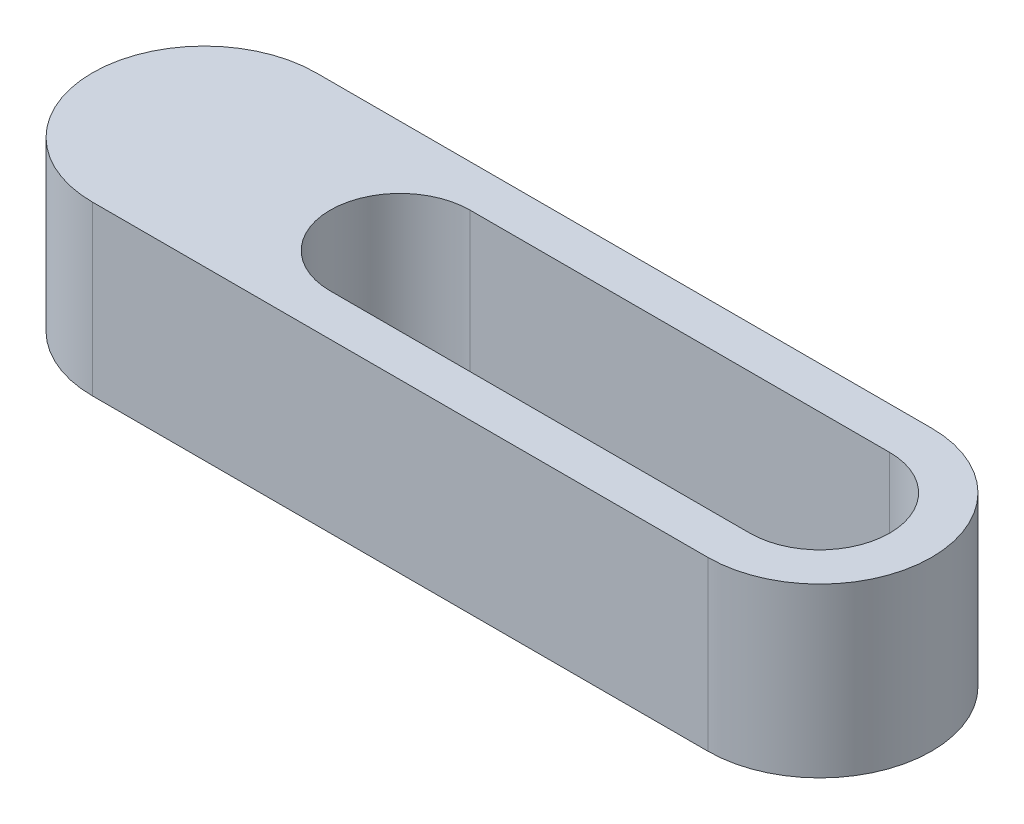
from build123d import *

# Parameters (mm, degrees)
Y_KSEKLIK_EKSTR_ZYON1_DEPTH  = 1
Y_KSEKLIK_EKSTR_ZYON2_DEPTH  = 5
IZIM3_W                      = 4
IZIM3_H                      = 1
KES_EKSTR_ZYON1_DEPTH        = 1
RADYUS1_R                    = 0.1
Y_KSEKLIK_EKSTR_ZYON4_DEPTH  = 9
Y_KSEKLIK_EKSTR_ZYON5_DEPTH  = 2.5
Y_KSEKLIK_EKSTR_ZYON6_DEPTH  = 3.5
Y_KSEKLIK_EKSTR_ZYON7_DEPTH  = 1
KES_EKSTR_ZYON2_DEPTH        = 1
Y_KSEKLIK_EKSTR_ZYON8_START  = 3
Y_KSEKLIK_EKSTR_ZYON8_DEPTH  = 3
RADYUS2_R                    = 0.5
Y_KSEKLIK_EKSTR_ZYON9_START  = 1
Y_KSEKLIK_EKSTR_ZYON9_DEPTH  = 1
IZIM11_R                     = 2.5
KES_EKSTR_ZYON3_DEPTH        = 10
IZIM15_R                     = 0.25
Y_KSEKLIK_EKSTR_ZYON12_DEPTH = 11
IZIM19_R                     = 2.25
Y_KSEKLIK_EKSTR_ZYON17_DEPTH = 5
IZIM20_R                     = 4.75
Y_KSEKLIK_EKSTR_ZYON18_DEPTH = 3
IZIM21_R                     = 0.75
KES_EKSTR_ZYON5_DEPTH        = 10
IZIM22_R                     = 0.5
Y_KSEKLIK_EKSTR_ZYON19_DEPTH = 5
IZIM23_R                     = 4
Y_KSEKLIK_EKSTR_ZYON20_DEPTH = 2
IZIM24_R                     = 0.75
Y_KSEKLIK_EKSTR_ZYON21_DEPTH = 7
IZIM25_R                     = 3.5
Y_KSEKLIK_EKSTR_ZYON22_DEPTH = 1
IZIM26_R                     = 4.5
Y_KSEKLIK_EKSTR_ZYON23_DEPTH = 1
KES_EKSTR_ZYON7_DEPTH        = 30
Y_KSEKLIK_EKSTR_ZYON33_DEPTH = 1
Y_KSEKLIK_EKSTR_ZYON34_DEPTH = 14
IZIM37_W                     = 8
IZIM37_H                     = 6
Y_KSEKLIK_EKSTR_ZYON36_DEPTH = 1
IZIM39_W                     = 4
IZIM39_H                     = 1
Y_KSEKLIK_EKSTR_ZYON37_DEPTH = 0.1
IZIM40_R                     = 0.4
Y_KSEKLIK_EKSTR_ZYON38_DEPTH = 2
IZIM41_R                     = 0.15
KES_EKSTR_ZYON8_DEPTH        = 5
SKETCH1_W                    = 21.818438076
SKETCH1_H                    = 34.383141715
CUT_EXTRUDE1_DEPTH           = 26
BOSS_EXTRUDE1_DEPTH          = 6
CUT_EXTRUDE2_START           = -8
CUT_EXTRUDE2_DEPTH           = 8


with BuildPart() as part:
    # Çizim1 → Yükseklik-Ekstrüzyon1 (new body)
    with BuildSketch(Plane(origin=(0, 0, 0), x_dir=(1, 0, 0), z_dir=(0, 1, 0))):
        with BuildLine():
            Line((-5.5, 11.25), (5.5, 11.25))
            ThreePointArc((5.5, 11.25), (5.853553391, 11.103553391), (6, 10.75))
            Line((6, 10.75), (6, -10.75))
            ThreePointArc((6, -10.75), (5.853553391, -11.103553391), (5.5, -11.25))
            Line((5.5, -11.25), (-5.5, -11.25))
            ThreePointArc((-5.5, -11.25), (-5.853553391, -11.103553391), (-6, -10.75))
            Line((-6, -10.75), (-6, 10.75))
            ThreePointArc((-6, 10.75), (-5.853553391, 11.103553391), (-5.5, 11.25))
        make_face()
    extrude(amount=Y_KSEKLIK_EKSTR_ZYON1_DEPTH)

    # Çizim2 → Yükseklik-Ekstrüzyon2 (add)
    with BuildSketch(Plane(origin=(0, 1, 0), x_dir=(1, 0, 0), z_dir=(0, 1, 0))):
        with BuildLine():
            Line((-5.5, 11.25), (5.5, 11.25))
            ThreePointArc((5.5, 11.25), (5.853553391, 11.103553391), (6, 10.75))
            Line((6, 10.75), (6, -10.75))
            ThreePointArc((6, -10.75), (5.853553391, -11.103553391), (5.5, -11.25))
            Line((5.5, -11.25), (-5.5, -11.25))
            ThreePointArc((-5.5, -11.25), (-5.853553391, -11.103553391), (-6, -10.75))
            Line((-6, -10.75), (-6, 10.75))
            ThreePointArc((-6, 10.75), (-5.853553391, 11.103553391), (-5.5, 11.25))
        make_face()
        with BuildLine():
            Line((-5, 9.25), (-5, -9.25))
            ThreePointArc((-5, -9.25), (-4.292893219, -9.542893219), (-4, -10.25))
            Line((-4, -10.25), (4, -10.25))
            ThreePointArc((4, -10.25), (4.292893219, -9.542893219), (5, -9.25))
            Line((5, -9.25), (5, 9.25))
            ThreePointArc((5, 9.25), (4.292893219, 9.542893219), (4, 10.25))
            Line((4, 10.25), (-4, 10.25))
            ThreePointArc((-4, 10.25), (-4.292893219, 9.542893219), (-5, 9.25))
        make_face(mode=Mode.SUBTRACT)
    extrude(amount=Y_KSEKLIK_EKSTR_ZYON2_DEPTH)

    # Çizim3 → Kes-Ekstrüzyon1 (cut)
    with BuildSketch(Plane(origin=(0, 6, 0), x_dir=(1, 0, 0), z_dir=(0, 1, 0))):
        with Locations((0, -10.75)):
            Rectangle(IZIM3_W, IZIM3_H)
    extrude(amount=-KES_EKSTR_ZYON1_DEPTH, mode=Mode.SUBTRACT)

    # Radyus1
    radyus1_edges = [part.edges().sort_by_distance(p)[0] for p in [
        (2, 5, 10.75),
        (-2, 5, 10.75),
    ]]
    fillet(radyus1_edges, radius=RADYUS1_R)

    # Çizim4 → Yükseklik-Ekstrüzyon4 (add)
    with BuildSketch(Plane(origin=(0, 6, 0), x_dir=(1, 0, 0), z_dir=(0, 1, 0))):
        with BuildLine():
            Line((-5.5, 11.25), (5.5, 11.25))
            ThreePointArc((5.5, 11.25), (5.853553391, 11.103553391), (6, 10.75))
            Line((6, 10.75), (6, -10.75))
            ThreePointArc((6, -10.75), (5.853553391, -11.103553391), (5.5, -11.25))
            Line((5.5, -11.25), (-5.5, -11.25))
            ThreePointArc((-5.5, -11.25), (-5.853553391, -11.103553391), (-6, -10.75))
            Line((-6, -10.75), (-6, 10.75))
            ThreePointArc((-6, 10.75), (-5.853553391, 11.103553391), (-5.5, 11.25))
        make_face()
        with BuildLine():
            Line((-4, 10.25), (4, 10.25))
            ThreePointArc((4, 10.25), (4.292893219, 9.542893219), (5, 9.25))
            Line((5, 9.25), (5, -9.25))
            ThreePointArc((5, -9.25), (4.292893219, -9.542893219), (4, -10.25))
            Line((4, -10.25), (-4, -10.25))
            ThreePointArc((-4, -10.25), (-4.292893219, -9.542893219), (-5, -9.25))
            Line((-5, -9.25), (-5, 9.25))
            ThreePointArc((-5, 9.25), (-4.292893219, 9.542893219), (-4, 10.25))
        make_face(mode=Mode.SUBTRACT)
    extrude(amount=Y_KSEKLIK_EKSTR_ZYON4_DEPTH)

    # Çizim6 → Yükseklik-Ekstrüzyon5 (add)
    with BuildSketch(Plane(origin=(0, 15, 0), x_dir=(1, 0, 0), z_dir=(0, 1, 0))):
        with BuildLine():
            Line((-5.5, 16), (-0.7, 16))
            ThreePointArc((-0.7, 16), (-0.558578644, 15.941421356), (-0.5, 15.8))
            Line((-0.5, 15.8), (-0.5, 14.224679434))
            ThreePointArc((-0.5, 14.224679434), (-0.522048696, 14.133392342), (-0.583333333, 14.062232862))
            ThreePointArc((-0.583333333, 14.062232862), (0, 12.25), (0.583333333, 14.062232862))
            ThreePointArc((0.583333333, 14.062232862), (0.522048696, 14.133392342), (0.5, 14.224679434))
            Line((0.5, 14.224679434), (0.5, 15.8))
            ThreePointArc((0.5, 15.8), (0.558578644, 15.941421356), (0.7, 16))
            Line((0.7, 16), (5.5, 16))
            ThreePointArc((5.5, 16), (5.853553391, 15.853553391), (6, 15.5))
            Line((6, 15.5), (6, -15.5))
            ThreePointArc((6, -15.5), (5.853553391, -15.853553391), (5.5, -16))
            Line((5.5, -16), (0.7, -16))
            ThreePointArc((0.7, -16), (0.558578644, -15.941421356), (0.5, -15.8))
            Line((0.5, -15.8), (0.5, -14.224679434))
            ThreePointArc((0.5, -14.224679434), (0.522048696, -14.133392342), (0.583333333, -14.062232862))
            ThreePointArc((0.583333333, -14.062232862), (0, -12.25), (-0.583333333, -14.062232862))
            ThreePointArc((-0.583333333, -14.062232862), (-0.522048696, -14.133392342), (-0.5, -14.224679434))
            Line((-0.5, -14.224679434), (-0.5, -15.8))
            ThreePointArc((-0.5, -15.8), (-0.558578644, -15.941421356), (-0.7, -16))
            Line((-0.7, -16), (-5.5, -16))
            ThreePointArc((-5.5, -16), (-5.853553391, -15.853553391), (-6, -15.5))
            Line((-6, -15.5), (-6, 15.5))
            ThreePointArc((-6, 15.5), (-5.853553391, 15.853553391), (-5.5, 16))
        make_face()
        with BuildLine():
            Line((-4, 10.25), (4, 10.25))
            ThreePointArc((4, 10.25), (4.292893219, 9.542893219), (5, 9.25))
            Line((5, 9.25), (5, -9.25))
            ThreePointArc((5, -9.25), (4.292893219, -9.542893219), (4, -10.25))
            Line((4, -10.25), (-4, -10.25))
            ThreePointArc((-4, -10.25), (-4.292893219, -9.542893219), (-5, -9.25))
            Line((-5, -9.25), (-5, 9.25))
            ThreePointArc((-5, 9.25), (-4.292893219, 9.542893219), (-4, 10.25))
        make_face(mode=Mode.SUBTRACT)
    extrude(amount=Y_KSEKLIK_EKSTR_ZYON5_DEPTH)

    # Çizim7 → Yükseklik-Ekstrüzyon6 (add)
    with BuildSketch(Plane(origin=(0, 17.5, 0), x_dir=(1, 0, 0), z_dir=(0, 1, 0))):
        with BuildLine():
            Line((5.5, 11.25), (-5.5, 11.25))
            ThreePointArc((-5.5, 11.25), (-5.853553391, 11.103553391), (-6, 10.75))
            Line((-6, 10.75), (-6, -10.75))
            ThreePointArc((-6, -10.75), (-5.853553391, -11.103553391), (-5.5, -11.25))
            Line((-5.5, -11.25), (5.5, -11.25))
            ThreePointArc((5.5, -11.25), (5.853553391, -11.103553391), (6, -10.75))
            Line((6, -10.75), (6, 10.75))
            ThreePointArc((6, 10.75), (5.853553391, 11.103553391), (5.5, 11.25))
        make_face()
        with BuildLine():
            Line((-5, -9.25), (-5, 9.25))
            ThreePointArc((-5, 9.25), (-4.292893219, 9.542893219), (-4, 10.25))
            Line((-4, 10.25), (4, 10.25))
            ThreePointArc((4, 10.25), (4.292893219, 9.542893219), (5, 9.25))
            Line((5, 9.25), (5, -9.25))
            ThreePointArc((5, -9.25), (4.292893219, -9.542893219), (4, -10.25))
            Line((4, -10.25), (-4, -10.25))
            ThreePointArc((-4, -10.25), (-4.292893219, -9.542893219), (-5, -9.25))
        make_face(mode=Mode.SUBTRACT)
    extrude(amount=Y_KSEKLIK_EKSTR_ZYON6_DEPTH)

    # Çizim8 → Yükseklik-Ekstrüzyon7 (add)
    with BuildSketch(Plane(origin=(0, 21, 0), x_dir=(1, 0, 0), z_dir=(0, 1, 0))):
        with BuildLine():
            Line((-5.5, 11.25), (5.5, 11.25))
            ThreePointArc((5.5, 11.25), (5.853553391, 11.103553391), (6, 10.75))
            Line((6, 10.75), (6, -10.75))
            ThreePointArc((6, -10.75), (5.853553391, -11.103553391), (5.5, -11.25))
            Line((5.5, -11.25), (-5.5, -11.25))
            ThreePointArc((-5.5, -11.25), (-5.853553391, -11.103553391), (-6, -10.75))
            Line((-6, -10.75), (-6, 10.75))
            ThreePointArc((-6, 10.75), (-5.853553391, 11.103553391), (-5.5, 11.25))
        make_face()
    extrude(amount=Y_KSEKLIK_EKSTR_ZYON7_DEPTH)

    # Çizim9 → Kes-Ekstrüzyon2 (cut)
    with BuildSketch(Plane(origin=(0, 22, 0), x_dir=(1, 0, 0), z_dir=(0, 1, 0))):
        with BuildLine():
            ThreePointArc((1.015291078, 0.354166667), (0, 10.25), (-1.015291078, 0.354166667))
            ThreePointArc((-1.015291078, 0.354166667), (0, -2.25), (1.015291078, 0.354166667))
        make_face()
    extrude(amount=-KES_EKSTR_ZYON2_DEPTH, mode=Mode.SUBTRACT)

    # Çizim9<3> → Yükseklik-Ekstrüzyon8 (add)
    with BuildSketch(Plane(origin=(0, 22, 0), x_dir=(1, 0, 0), z_dir=(0, 1, 0)).offset(Y_KSEKLIK_EKSTR_ZYON8_START)):
        with BuildLine():
            ThreePointArc((2.445144707, -0.229166667), (0, 11.25), (-2.445144707, -0.229166667))
            ThreePointArc((-2.445144707, -0.229166667), (0, -3.25), (2.445144707, -0.229166667))
        make_face()
        with BuildLine():
            ThreePointArc((1.015291078, 0.354166667), (0, 10.25), (-1.015291078, 0.354166667))
            ThreePointArc((-1.015291078, 0.354166667), (0, -2.25), (1.015291078, 0.354166667))
        make_face(mode=Mode.SUBTRACT)
    extrude(amount=-Y_KSEKLIK_EKSTR_ZYON8_DEPTH)

    # Radyus2
    radyus2_edges = [part.edges().sort_by_distance(p)[0] for p in [
        (-1.015291078, 23, -0.354166667),
        (1.015291078, 23, -0.354166667),
    ]]
    fillet(radyus2_edges, radius=RADYUS2_R)

    # Çizim10 → Yükseklik-Ekstrüzyon9 (add)
    with BuildSketch(Plane(origin=(0, 25, 0), x_dir=(1, 0, 0), z_dir=(0, 1, 0)).offset(Y_KSEKLIK_EKSTR_ZYON9_START)):
        with BuildLine():
            ThreePointArc((2.445144707, -0.229166667), (0, 11.25), (-2.445144707, -0.229166667))
            ThreePointArc((-2.445144707, -0.229166667), (0, -3.25), (2.445144707, -0.229166667))
        make_face()
    extrude(amount=-Y_KSEKLIK_EKSTR_ZYON9_DEPTH)

    # Çizim11 → Kes-Ekstrüzyon3 (cut)
    with BuildSketch(Plane(origin=(0, 26, 0), x_dir=(1, 0, 0), z_dir=(0, 1, 0))):
        with Locations(Location((0, 5.25, 0), (0, 0, 270))):
            Circle(IZIM11_R)
    extrude(amount=-KES_EKSTR_ZYON3_DEPTH, mode=Mode.SUBTRACT)

    # Çizim15 → Yükseklik-Ekstrüzyon12 (add)
    with BuildSketch(Plane(origin=(0, 26, 0), x_dir=(1, 0, 0), z_dir=(0, 1, 0))):
        with Locations(Location((0, -0.75, 0), (0, 0, 270))):
            Circle(IZIM15_R)
    extrude(amount=-Y_KSEKLIK_EKSTR_ZYON12_DEPTH)



with BuildPart() as body_2:
    # Çizim19 → Yükseklik-Ekstrüzyon17 (new body)
    with BuildSketch(Plane(origin=(0, 30, 0), x_dir=(1, 0, 0), z_dir=(0, 1, 0))):
        with Locations(Location((0, 5.25, 0), (0, 0, 270))):
            Circle(IZIM19_R)
    extrude(amount=-Y_KSEKLIK_EKSTR_ZYON17_DEPTH)


with BuildPart() as part_1:
    add(part.part)

    add(body_2.part)  # Yükseklik-Ekstrüzyon18 merges body 2
    # Çizim20 → Yükseklik-Ekstrüzyon18 (add)
    with BuildSketch(Plane.XZ.offset(-25)):
        with Locations(Location((0, -5.25, 0), (0, 0, 90))):
            Circle(IZIM20_R)
    extrude(amount=Y_KSEKLIK_EKSTR_ZYON18_DEPTH)

    # Çizim21 → Kes-Ekstrüzyon5 (cut)
    with BuildSketch(Plane(origin=(0, 30, 0), x_dir=(1, 0, 0), z_dir=(0, 1, 0))):
        with Locations(Location((0, 5.25, 0), (0, 0, 270))):
            Circle(IZIM21_R)
    extrude(amount=-KES_EKSTR_ZYON5_DEPTH, mode=Mode.SUBTRACT)

    # Çizim22 → Yükseklik-Ekstrüzyon19 (add)
    with BuildSketch(Plane(origin=(0, 25.5, 0), x_dir=(1, 0, 0), z_dir=(0, 1, 0))):
        with Locations(Location((0, -0.75, 0), (0, 0, 270))):
            Circle(IZIM22_R)
    extrude(amount=-Y_KSEKLIK_EKSTR_ZYON19_DEPTH)

    # Çizim23 → Yükseklik-Ekstrüzyon20 (add)
    with BuildSketch(Plane.XZ.offset(-20.5)):
        with Locations(Location((0, 0.75, 0), (0, 0, 270))):
            Circle(IZIM23_R)
    extrude(amount=Y_KSEKLIK_EKSTR_ZYON20_DEPTH)

    # Çizim26 → Yükseklik-Ekstrüzyon23 (add)
    with BuildSketch(Plane(origin=(0, 17.5, 0), x_dir=(-1, 0, 0), z_dir=(0, -1, 0))):
        with Locations(Location((0, -0.75, 0), (0, 0, 90))):
            Circle(IZIM26_R)
    extrude(amount=Y_KSEKLIK_EKSTR_ZYON23_DEPTH)

    # Çizim32 → Kes-Ekstrüzyon7 (cut)
    with BuildSketch(Plane(origin=(0, 0, 10.25), x_dir=(-1, 0, 0), z_dir=(0, 0, -1))):
        with BuildLine():
            Line((2, 6), (-2, 6))
            Line((-2, 6), (-2, 5.1))
            ThreePointArc((-2, 5.1), (-1.970710678, 5.029289322), (-1.9, 5))
            Line((-1.9, 5), (1.9, 5))
            ThreePointArc((1.9, 5), (1.970710678, 5.029289322), (2, 5.1))
            Line((2, 5.1), (2, 6))
        make_face()
    extrude(amount=KES_EKSTR_ZYON7_DEPTH, mode=Mode.SUBTRACT)

    # Çizim33 → Yükseklik-Ekstrüzyon33 (add)
    with BuildSketch(Plane.XY.offset(11.25)):
        with BuildLine():
            Line((-2, 6), (2, 6))
            Line((2, 6), (2, 5.1))
            ThreePointArc((2, 5.1), (1.970710678, 5.029289322), (1.9, 5))
            Line((1.9, 5), (-1.9, 5))
            ThreePointArc((-1.9, 5), (-1.970710678, 5.029289322), (-2, 5.1))
            Line((-2, 5.1), (-2, 6))
        make_face()
    extrude(amount=-Y_KSEKLIK_EKSTR_ZYON33_DEPTH)

    # Çizim34 → Yükseklik-Ekstrüzyon34 (add)
    with BuildSketch(Plane(origin=(0, 1, 0), x_dir=(1, 0, 0), z_dir=(0, 1, 0))):
        with BuildLine():
            Line((-3, -3.25), (3, -3.25))
            ThreePointArc((3, -3.25), (3.707106781, -3.542893219), (4, -4.25))
            Line((4, -4.25), (4, -8.25))
            ThreePointArc((4, -8.25), (3.707106781, -8.957106781), (3, -9.25))
            Line((3, -9.25), (-3, -9.25))
            ThreePointArc((-3, -9.25), (-3.707106781, -8.957106781), (-4, -8.25))
            Line((-4, -8.25), (-4, -4.25))
            ThreePointArc((-4, -4.25), (-3.707106781, -3.542893219), (-3, -3.25))
        make_face()
    extrude(amount=Y_KSEKLIK_EKSTR_ZYON34_DEPTH)

    # Çizim37 → Yükseklik-Ekstrüzyon36 (add)
    with BuildSketch(Plane(origin=(0, 1, 0), x_dir=(-1, 0, 0), z_dir=(0, -1, 0))):
        with Locations((0, -6.25)):
            Rectangle(IZIM37_W, IZIM37_H)
    extrude(amount=-Y_KSEKLIK_EKSTR_ZYON36_DEPTH)

    # Çizim39 → Yükseklik-Ekstrüzyon37 (add)
    with BuildSketch(Plane(origin=(0, 0, -10.75), x_dir=(-1, 0, 0), z_dir=(0, 0, -1))):
        with Locations((0, 5.514566781)):
            Rectangle(IZIM39_W, IZIM39_H)
    extrude(amount=Y_KSEKLIK_EKSTR_ZYON37_DEPTH)

    # Çizim40 → Yükseklik-Ekstrüzyon38 (add)
    with BuildSketch(Plane(origin=(0, 0, -10.85), x_dir=(-1, 0, 0), z_dir=(0, 0, -1))):
        with Locations((0, 5.55)):
            Circle(IZIM40_R)
        with Locations((1, 5.55)):
            Circle(IZIM40_R)
        with Locations((-1, 5.55)):
            Circle(IZIM40_R)
    extrude(amount=Y_KSEKLIK_EKSTR_ZYON38_DEPTH)

    # Çizim41 → Kes-Ekstrüzyon8 (cut)
    with BuildSketch(Plane(origin=(0, 30, 0), x_dir=(1, 0, 0), z_dir=(0, 1, 0))):
        with Locations((-2.25, 5.25)):
            Circle(IZIM41_R)
        with Locations((-2.213841574, 5.651753013)):
            Circle(IZIM41_R)
        with Locations((-2.106528459, 6.040593354)):
            Circle(IZIM41_R)
        with Locations((-1.931509786, 6.404023374)):
            Circle(IZIM41_R)
        with Locations((-1.694410799, 6.730362133)):
            Circle(IZIM41_R)
        with Locations((-1.402852054, 7.009120836)):
            Circle(IZIM41_R)
        with Locations((-1.066204491, 7.231339947)):
            Circle(IZIM41_R)
        with Locations((-0.695288237, 7.389877162)):
            Circle(IZIM41_R)
        with Locations((-0.302024848, 7.479636964)):
            Circle(IZIM41_R)
        with Locations((0.100945868, 7.4977344)):
            Circle(IZIM41_R)
        with Locations((0.500672101, 7.443587802)):
            Circle(IZIM41_R)
        with Locations((0.884306321, 7.318937488)):
            Circle(IZIM41_R)
        with Locations((1.239518208, 7.127789821)):
            Circle(IZIM41_R)
        with Locations((1.55489096, 6.876288444)):
            Circle(IZIM41_R)
        with Locations((1.820288237, 6.572516818)):
            Circle(IZIM41_R)
        with Locations((2.027179953, 6.226238413)):
            Circle(IZIM41_R)
        with Locations((2.168916437, 5.848582903)):
            Circle(IZIM41_R)
        with Locations((2.240942161, 5.451688445)):
            Circle(IZIM41_R)
        with Locations((2.240942161, 5.048311555)):
            Circle(IZIM41_R)
        with Locations((2.168916437, 4.651417097)):
            Circle(IZIM41_R)
        with Locations((2.027179953, 4.273761587)):
            Circle(IZIM41_R)
        with Locations((1.820288237, 3.927483182)):
            Circle(IZIM41_R)
        with Locations((1.55489096, 3.623711556)):
            Circle(IZIM41_R)
        with Locations((1.239518208, 3.372210179)):
            Circle(IZIM41_R)
        with Locations((0.884306321, 3.181062512)):
            Circle(IZIM41_R)
        with Locations((0.500672101, 3.056412198)):
            Circle(IZIM41_R)
        with Locations((0.100945868, 3.0022656)):
            Circle(IZIM41_R)
        with Locations((-0.302024848, 3.020363036)):
            Circle(IZIM41_R)
        with Locations((-0.695288237, 3.110122838)):
            Circle(IZIM41_R)
        with Locations((-1.066204491, 3.268660053)):
            Circle(IZIM41_R)
        with Locations((-1.402852054, 3.490879164)):
            Circle(IZIM41_R)
        with Locations((-1.694410799, 3.769637867)):
            Circle(IZIM41_R)
        with Locations((-1.931509786, 4.095976626)):
            Circle(IZIM41_R)
        with Locations((-2.106528459, 4.459406646)):
            Circle(IZIM41_R)
        with Locations((-2.213841574, 4.848246987)):
            Circle(IZIM41_R)
    extrude(amount=-KES_EKSTR_ZYON8_DEPTH, mode=Mode.SUBTRACT)


with BuildPart() as body_2_2:
    # Çizim24 → Yükseklik-Ekstrüzyon21 (new body)
    with BuildSketch(Plane.XZ.offset(-22)):
        with Locations(Location((0, -5.25, 0), (0, 0, 90))):
            Circle(IZIM24_R)
    extrude(amount=Y_KSEKLIK_EKSTR_ZYON21_DEPTH)

    # Çizim25 → Yükseklik-Ekstrüzyon22 (add)
    with BuildSketch(Plane(origin=(0, 19, 0), x_dir=(-1, 0, 0), z_dir=(0, -1, 0))):
        with Locations(Location((0, 5.25, 0), (0, 0, 90))):
            Circle(IZIM25_R)
    extrude(amount=Y_KSEKLIK_EKSTR_ZYON22_DEPTH)


with BuildPart() as cut_extrude1_tool:
    # Sketch1 → Cut-Extrude1 (new body)
    with BuildSketch(Plane.XZ):
        with Locations((-1.613036278, 0.12734497)):
            Rectangle(SKETCH1_W, SKETCH1_H)
    extrude(amount=-CUT_EXTRUDE1_DEPTH)


with BuildPart() as part_2:
    add(part_1.part)

    # Cut-Extrude1: cut by cut_extrude1_tool
    add(cut_extrude1_tool.part, mode=Mode.SUBTRACT)

    # Sketch2 → Boss-Extrude1 (add)
    with BuildSketch(Plane(origin=(0, 30, 0), x_dir=(1, 0, 0), z_dir=(0, 1, 0))):
        with BuildLine():
            Line((0, 9.25), (22, 9.25))
            ThreePointArc((22, 9.25), (26, 5.25), (22, 1.25))
            Line((22, 1.25), (0, 1.25))
            ThreePointArc((0, 1.25), (-4, 5.25), (0, 9.25))
        make_face()
        with BuildLine():
            Line((7, 7.75), (22, 7.75))
            ThreePointArc((22, 7.75), (24.5, 5.25), (22, 2.75))
            Line((22, 2.75), (7, 2.75))
            ThreePointArc((7, 2.75), (4.5, 5.25), (7, 7.75))
        make_face(mode=Mode.SUBTRACT)
    extrude(amount=BOSS_EXTRUDE1_DEPTH)

    # Sketch3 → Cut-Extrude2 (cut)
    with BuildSketch(Plane.XZ.offset(-26).offset(CUT_EXTRUDE2_START)):
        with BuildLine():
            ThreePointArc((-0.449913544, -3.045441585), (-0.281889858, -3.1690055), (-0.15279382, -3.005193984))
            ThreePointArc((-0.15279382, -3.005193984), (-0.100945868, -3.0022656), (-0.049044143, -3.000534581))
            ThreePointArc((-0.049044143, -3.000534581), (0.094216144, -3.15211456), (0.250487232, -3.01398655))
            ThreePointArc((0.250487232, -3.01398655), (0.302024848, -3.020363036), (0.353401576, -3.027927246))
            ThreePointArc((0.353401576, -3.027927246), (0.467293961, -3.202651384), (0.645717417, -3.094646429))
            ThreePointArc((0.645717417, -3.094646429), (0.695288237, -3.110122838), (0.744488679, -3.126739157))
            ThreePointArc((0.744488679, -3.126739157), (0.825352566, -3.318991678), (1.020193713, -3.244581144))
            ThreePointArc((1.020193713, -3.244581144), (1.066204491, -3.268660053), (1.111647302, -3.293794419))
            ThreePointArc((1.111647302, -3.293794419), (1.156883661, -3.497396167), (1.361880144, -3.458971672))
            ThreePointArc((1.361880144, -3.458971672), (1.402852054, -3.490879164), (1.443076667, -3.523723738))
            ThreePointArc((1.443076667, -3.523723738), (1.451231563, -3.732130786), (1.659794627, -3.730927323))
            ThreePointArc((1.659794627, -3.730927323), (1.694410799, -3.769637867), (1.72812436, -3.809136996))
            ThreePointArc((1.72812436, -3.809136996), (1.698935688, -4.01565097), (1.904361944, -4.051707221))
            ThreePointArc((1.904361944, -4.051707221), (1.931509786, -4.095976626), (1.957628715, -4.140860777))
            ThreePointArc((1.957628715, -4.140860777), (1.892034623, -4.338844148), (2.087721502, -4.411001234))
            ThreePointArc((2.087721502, -4.411001234), (2.106528459, -4.459406646), (2.124213271, -4.508233205))
            ThreePointArc((2.124213271, -4.508233205), (2.024322007, -4.691322624), (2.203979973, -4.797261358))
            ThreePointArc((2.203979973, -4.797261358), (2.213841574, -4.848246987), (2.222523866, -4.899446628))
            ThreePointArc((2.222523866, -4.899446628), (2.091546017, -5.061757451), (2.249400714, -5.198072875))
            ThreePointArc((2.249400714, -5.198072875), (2.25, -5.25), (2.249400714, -5.301927125))
            ThreePointArc((2.249400714, -5.301927125), (2.091546017, -5.438242549), (2.222523866, -5.600553372))
            ThreePointArc((2.222523866, -5.600553372), (2.213841574, -5.651753013), (2.203979973, -5.702738642))
            ThreePointArc((2.203979973, -5.702738642), (2.024322007, -5.808677376), (2.124213271, -5.991766795))
            ThreePointArc((2.124213271, -5.991766795), (2.106528459, -6.040593354), (2.087721502, -6.088998766))
            ThreePointArc((2.087721502, -6.088998766), (1.892034623, -6.161155852), (1.957628715, -6.359139223))
            ThreePointArc((1.957628715, -6.359139223), (1.931509786, -6.404023374), (1.904361944, -6.448292779))
            ThreePointArc((1.904361944, -6.448292779), (1.698935688, -6.48434903), (1.72812436, -6.690863004))
            ThreePointArc((1.72812436, -6.690863004), (1.694410799, -6.730362133), (1.659794627, -6.769072677))
            ThreePointArc((1.659794627, -6.769072677), (1.451231563, -6.767869214), (1.443076667, -6.976276262))
            ThreePointArc((1.443076667, -6.976276262), (1.402852054, -7.009120836), (1.361880144, -7.041028328))
            ThreePointArc((1.361880144, -7.041028328), (1.156883661, -7.002603833), (1.111647302, -7.206205581))
            ThreePointArc((1.111647302, -7.206205581), (1.066204491, -7.231339947), (1.020193713, -7.255418856))
            ThreePointArc((1.020193713, -7.255418856), (0.825352566, -7.181008322), (0.744488679, -7.373260843))
            ThreePointArc((0.744488679, -7.373260843), (0.695288237, -7.389877162), (0.645717417, -7.405353571))
            ThreePointArc((0.645717417, -7.405353571), (0.467293961, -7.297348616), (0.353401576, -7.472072754))
            ThreePointArc((0.353401576, -7.472072754), (0.302024848, -7.479636964), (0.250487232, -7.48601345))
            ThreePointArc((0.250487232, -7.48601345), (0.094216144, -7.34788544), (-0.049044143, -7.499465419))
            ThreePointArc((-0.049044143, -7.499465419), (-0.100945868, -7.4977344), (-0.15279382, -7.494806016))
            ThreePointArc((-0.15279382, -7.494806016), (-0.281889858, -7.3309945), (-0.449913544, -7.454558415))
            ThreePointArc((-0.449913544, -7.454558415), (-0.500672101, -7.443587802), (-0.551163952, -7.43144867))
            ThreePointArc((-0.551163952, -7.43144867), (-0.648935688, -7.247218684), (-0.836322353, -7.338795089))
            ThreePointArc((-0.836322353, -7.338795089), (-0.884306321, -7.318937488), (-0.931819221, -7.297977768))
            ThreePointArc((-0.931819221, -7.297977768), (-0.995124191, -7.099250617), (-1.195851074, -7.15589617))
            ThreePointArc((-1.195851074, -7.15589617), (-1.239518208, -7.127789821), (-1.282525054, -7.098683176))
            ThreePointArc((-1.282525054, -7.098683176), (-1.309328584, -6.891846113), (-1.516944157, -6.91174018))
            ThreePointArc((-1.516944157, -6.91174018), (-1.55489096, -6.876288444), (-1.592009476, -6.839970386))
            ThreePointArc((-1.592009476, -6.839970386), (-1.581450079, -6.631671324), (-1.789281407, -6.614174493))
            ThreePointArc((-1.789281407, -6.614174493), (-1.820288237, -6.572516818), (-1.850325404, -6.53015464))
            ThreePointArc((-1.850325404, -6.53015464), (-1.802742467, -6.327088483), (-2.00410968, -6.272763116))
            ThreePointArc((-2.00410968, -6.272763116), (-2.027179953, -6.226238413), (-2.04917035, -6.179193669))
            ThreePointArc((-2.04917035, -6.179193669), (-1.966093228, -5.987887131), (-2.154524219, -5.898479291))
            ThreePointArc((-2.154524219, -5.898479291), (-2.168916437, -5.848582903), (-2.182153276, -5.79836765))
            ThreePointArc((-2.182153276, -5.79836765), (-2.066252136, -5.624969479), (-2.235690577, -5.503352807))
            ThreePointArc((-2.235690577, -5.503352807), (-2.240942161, -5.451688445), (-2.245, -5.399916644))
            ThreePointArc((-2.245, -5.399916644), (-2.1, -5.25), (-2.245, -5.100083356))
            ThreePointArc((-2.245, -5.100083356), (-2.240942161, -5.048311555), (-2.235690577, -4.996647193))
            ThreePointArc((-2.235690577, -4.996647193), (-2.066252136, -4.875030521), (-2.182153276, -4.70163235))
            ThreePointArc((-2.182153276, -4.70163235), (-2.168916437, -4.651417097), (-2.154524219, -4.601520709))
            ThreePointArc((-2.154524219, -4.601520709), (-1.966093228, -4.512112869), (-2.04917035, -4.320806331))
            ThreePointArc((-2.04917035, -4.320806331), (-2.027179953, -4.273761587), (-2.00410968, -4.227236884))
            ThreePointArc((-2.00410968, -4.227236884), (-1.802742467, -4.172911517), (-1.850325404, -3.96984536))
            ThreePointArc((-1.850325404, -3.96984536), (-1.820288237, -3.927483182), (-1.789281407, -3.885825507))
            ThreePointArc((-1.789281407, -3.885825507), (-1.581450079, -3.868328676), (-1.592009476, -3.660029614))
            ThreePointArc((-1.592009476, -3.660029614), (-1.55489096, -3.623711556), (-1.516944157, -3.58825982))
            ThreePointArc((-1.516944157, -3.58825982), (-1.309328584, -3.608153887), (-1.282525054, -3.401316824))
            ThreePointArc((-1.282525054, -3.401316824), (-1.239518208, -3.372210179), (-1.195851074, -3.34410383))
            ThreePointArc((-1.195851074, -3.34410383), (-0.995124191, -3.400749383), (-0.931819221, -3.202022232))
            ThreePointArc((-0.931819221, -3.202022232), (-0.884306321, -3.181062512), (-0.836322353, -3.161204912))
            ThreePointArc((-0.836322353, -3.161204912), (-0.648935688, -3.252781316), (-0.551163952, -3.06855133))
            ThreePointArc((-0.551163952, -3.06855133), (-0.500672101, -3.056412198), (-0.449913544, -3.045441585))
        make_face()
    extrude(amount=CUT_EXTRUDE2_DEPTH, mode=Mode.SUBTRACT)


with BuildPart() as body_2_2_1:
    add(body_2_2.part)

    # Cut-Extrude1: cut by cut_extrude1_tool
    add(cut_extrude1_tool.part, mode=Mode.SUBTRACT)


solid = part_2.part
